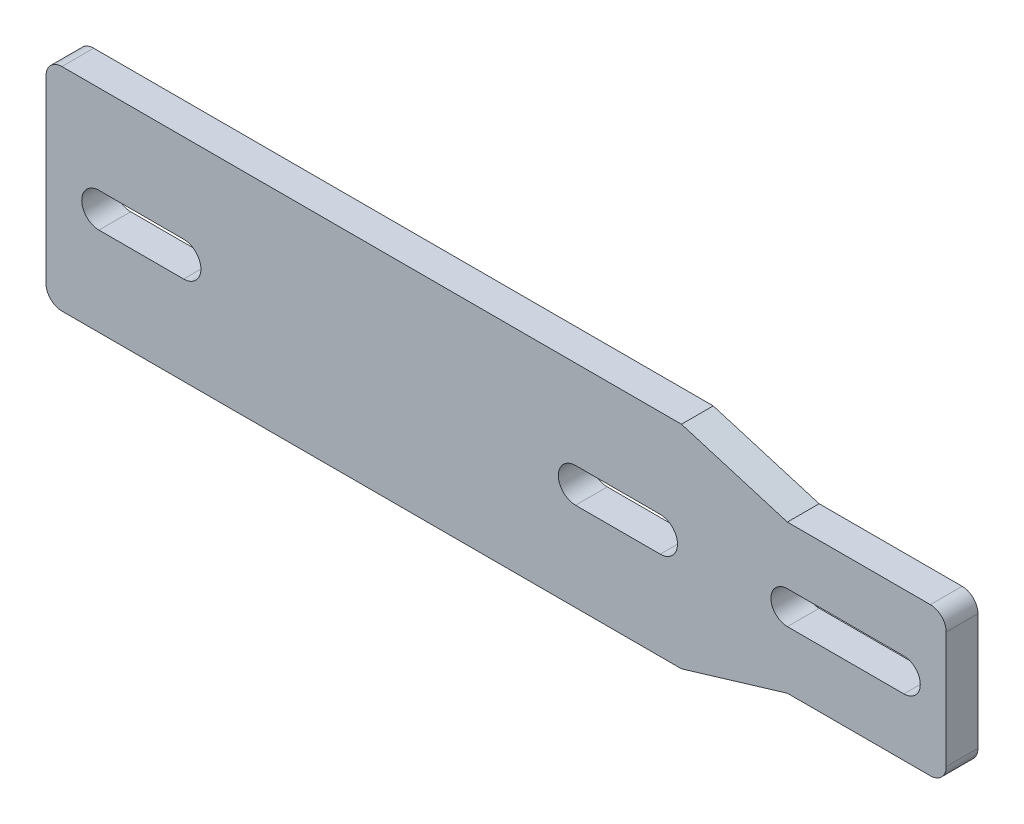
from build123d import *

# Parameters (mm, degrees)
EXTRUDE_1_DEPTH        = 6
CUT_EXTRUDE_1_DEPTH    = 6
CUT_EXTRUDE_2_DEPTH    = 6
PATTERN_LINEAR_1_COUNT = 2
PATTERN_LINEAR_1_PITCH = 90
FILLET_1_R             = 3


with BuildPart() as part:
    # 草图1 → 凸台-拉伸1 (new body)
    with BuildSketch(Plane.XY):
        Polygon((120, 40), (140, 34), (170, 34), (170, 6), (140, 6), (120, 0), (0, 0), (0, 40), align=None)
    extrude(amount=EXTRUDE_1_DEPTH)

    # 草图2 → 切除-拉伸1 (cut)
    with BuildSketch(Plane.XY.offset(6)):
        with BuildLine():
            Line((10, 23.25), (26, 23.25))
            ThreePointArc((26, 23.25), (29.25, 20), (26, 16.75))
            Line((26, 16.75), (10, 16.75))
            ThreePointArc((10, 16.75), (6.75, 20), (10, 23.25))
        make_face()
    cut_extrude_1 = extrude(amount=-CUT_EXTRUDE_1_DEPTH, mode=Mode.SUBTRACT)

    # 草图3 → 切除-拉伸2 (cut)
    with BuildSketch(Plane.XY.offset(6)):
        with BuildLine():
            Line((140, 23.1), (162, 23.1))
            ThreePointArc((162, 23.1), (165.1, 20), (162, 16.9))
            Line((162, 16.9), (140, 16.9))
            ThreePointArc((140, 16.9), (136.9, 20), (140, 23.1))
        make_face()
    extrude(amount=-CUT_EXTRUDE_2_DEPTH, mode=Mode.SUBTRACT)

    # 阵列(线性)1: 切除-拉伸1 ×2
    with Locations(*[(i * PATTERN_LINEAR_1_PITCH, 0, 0) for i in range(1, PATTERN_LINEAR_1_COUNT)]):
        add(cut_extrude_1, mode=Mode.SUBTRACT)

    # 圆角1
    fillet_1_edges = [part.edges().sort_by_distance(p)[0] for p in [
        (0, 40, 3),
        (170, 34, 3),
        (170, 6, 3),
        (0, 0, 3),
    ]]
    fillet(fillet_1_edges, radius=FILLET_1_R)


solid = part.part
